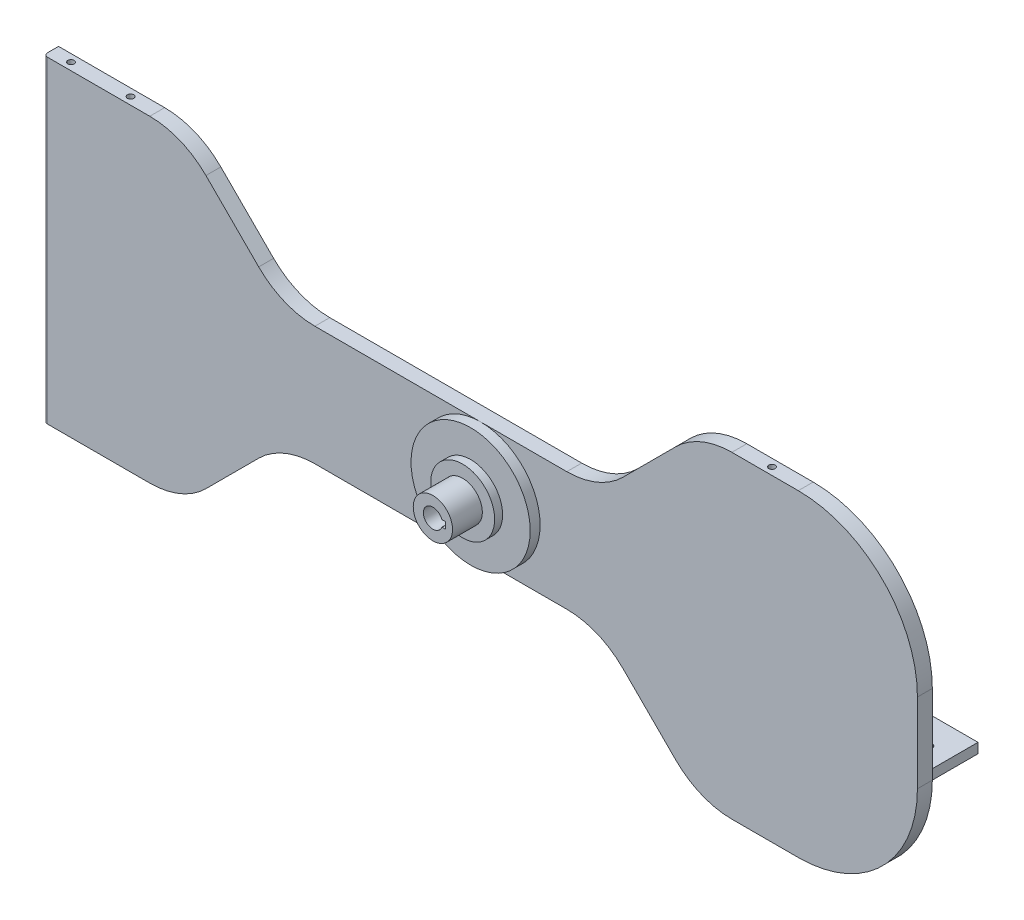
from build123d import *

# Parameters (mm, degrees)
BOSS_EXTRUDE1_DEPTH        = 9.525
SKETCH6_W                  = 509.27
SKETCH6_H                  = 6.35
BOSS_EXTRUDE3_DEPTH        = 35.56
SKETCH7_R                  = 2.286
CUT_EXTRUDE4_DEPTH         = 575.152378381
F_10_32_TAPPED_HOLE1_D     = 4.0386
F_10_32_TAPPED_HOLE1_DEPTH = 13.716
F_10_32_TAPPED_HOLE1_TIP   = 1.213317848
F_10_32_TAPPED_HOLE2_D     = 4.0386
F_10_32_TAPPED_HOLE2_DEPTH = 13.716
F_10_32_TAPPED_HOLE2_TIP   = 1.213317848
SKETCH12_R                 = 38.1
BOSS_EXTRUDE4_DEPTH        = 6.35
SKETCH13_R                 = 20.447
BOSS_EXTRUDE5_DEPTH        = 5.08
SKETCH14_R                 = 12.573
BOSS_EXTRUDE6_DEPTH        = 19.05
CUT_EXTRUDE5_DEPTH         = 19.05
FILLET1_R                  = 2.54
F_10_32_TAPPED_HOLE3_D     = 4.0386


with BuildPart() as part:
    # Sketch1 → Boss-Extrude1 (new body)
    with BuildSketch(Plane.XY):
        with BuildLine():
            Line((103.778975516, 188.321024484), (137.521024484, 154.578975516))
            ThreePointArc((137.521024484, 154.578975516), (154.001730604, 143.566919748), (173.442048969, 139.7))
            Line((173.442048969, 139.7), (334.557951031, 139.7))
            ThreePointArc((334.557951031, 139.7), (353.998269396, 143.566919748), (370.478975516, 154.578975516))
            Line((370.478975516, 154.578975516), (404.221024484, 188.321024484))
            ThreePointArc((404.221024484, 188.321024484), (420.701730604, 199.333080252), (440.142048969, 203.2))
            Line((440.142048969, 203.2), (482.6, 203.2))
            ThreePointArc((482.6, 203.2), (536.481536726, 180.881536726), (558.8, 127))
            Line((558.8, 127), (558.8, 76.2))
            ThreePointArc((558.8, 76.2), (536.481536726, 22.318463274), (482.6, 0))
            Line((482.6, 0), (440.142048969, 0))
            ThreePointArc((440.142048969, 0), (420.701730604, 3.866919748), (404.221024484, 14.878975516))
            Line((404.221024484, 14.878975516), (370.478975516, 48.621024484))
            ThreePointArc((370.478975516, 48.621024484), (353.998269396, 59.633080252), (334.557951031, 63.5))
            Line((334.557951031, 63.5), (173.442048969, 63.5))
            ThreePointArc((173.442048969, 63.5), (154.001730604, 59.633080252), (137.521024484, 48.621024484))
            Line((137.521024484, 48.621024484), (103.778975516, 14.878975516))
            ThreePointArc((103.778975516, 14.878975516), (87.298269396, 3.866919748), (67.857951031, 0))
            Line((67.857951031, 0), (0, 0))
            Line((0, 0), (0, 203.2))
            Line((0, 203.2), (67.857951031, 203.2))
            ThreePointArc((67.857951031, 203.2), (87.298269396, 199.333080252), (103.778975516, 188.321024484))
        make_face()
    extrude(amount=BOSS_EXTRUDE1_DEPTH)

    # Sketch6 → Boss-Extrude3 (add)
    with BuildSketch(Plane(origin=(0, 0, 0), x_dir=(-1, 0, 0), z_dir=(0, 0, -1))):
        with Locations((-297.815, 73.025)):
            Rectangle(SKETCH6_W, SKETCH6_H)
    extrude(amount=BOSS_EXTRUDE3_DEPTH)

    # Sketch7 → Cut-Extrude4 (cut, through all)
    with BuildSketch(Plane(origin=(0, 76.2, 0), x_dir=(1, 0, 0), z_dir=(0, 1, 0))):
        with Locations(Location((58.166, 17.78, 0), (0, 0, 270))):
            Circle(SKETCH7_R)
        with Locations(Location((538.734, 17.78, 0), (0, 0, 270))):
            Circle(SKETCH7_R)
    extrude(amount=-CUT_EXTRUDE4_DEPTH, mode=Mode.SUBTRACT)

    # #10-32 Tapped Hole1
    with Locations(Plane(origin=(0, 203.2, 0), x_dir=(-1, 0, 0), z_dir=(0, 1, 0))):
        with Locations((-12.7, 4.7625), (-50.8, 4.7625), (-461.01, 4.7625)):
            Hole(F_10_32_TAPPED_HOLE1_D / 2, depth=F_10_32_TAPPED_HOLE1_DEPTH)
            with Locations((0, 0, -(F_10_32_TAPPED_HOLE1_DEPTH + F_10_32_TAPPED_HOLE1_TIP / 2))):  # 118° drill point
                Cone(0, F_10_32_TAPPED_HOLE1_D / 2, F_10_32_TAPPED_HOLE1_TIP, mode=Mode.SUBTRACT)

    # #10-32 Tapped Hole2
    with Locations(Plane.XZ):
        with Locations((12.7, 4.7625), (50.8, 4.7625), (461.01, 4.7625)):
            Hole(F_10_32_TAPPED_HOLE2_D / 2, depth=F_10_32_TAPPED_HOLE2_DEPTH)
            with Locations((0, 0, -(F_10_32_TAPPED_HOLE2_DEPTH + F_10_32_TAPPED_HOLE2_TIP / 2))):  # 118° drill point
                Cone(0, F_10_32_TAPPED_HOLE2_D / 2, F_10_32_TAPPED_HOLE2_TIP, mode=Mode.SUBTRACT)

    # Sketch12 → Boss-Extrude4 (add)
    with BuildSketch(Plane.XY.offset(9.525)):
        with Locations(Location((279.4, 101.6, 0), (0, 0, 270))):
            Circle(SKETCH12_R)
    extrude(amount=BOSS_EXTRUDE4_DEPTH)

    # Sketch13 → Boss-Extrude5 (add)
    with BuildSketch(Plane.XY.offset(15.875)):
        with Locations((279.4, 101.6)):
            Circle(SKETCH13_R)
    extrude(amount=BOSS_EXTRUDE5_DEPTH)

    # Sketch14 → Boss-Extrude6 (add)
    with BuildSketch(Plane.XY.offset(20.955)):
        with Locations(Location((279.4, 101.6, 0), (0, 0, 180))):
            Circle(SKETCH14_R)
    extrude(amount=BOSS_EXTRUDE6_DEPTH)

    # Sketch15 → Cut-Extrude5 (cut)
    with BuildSketch(Plane.XY.offset(40.005)):
        with BuildLine():
            Line((287.401, 103.7082), (287.401, 99.4918))
            Line((287.401, 99.4918), (285.294277832, 99.4918))
            ThreePointArc((285.294277832, 99.4918), (285.151947147, 99.448175797), (285.058506719, 99.332288))
            ThreePointArc((285.058506719, 99.332288), (273.304, 101.6), (285.058506719, 103.867712))
            ThreePointArc((285.058506719, 103.867712), (285.151947147, 103.751824203), (285.294277832, 103.7082))
            Line((285.294277832, 103.7082), (287.401, 103.7082))
        make_face()
    extrude(amount=-CUT_EXTRUDE5_DEPTH, mode=Mode.SUBTRACT)

    # Fillet1
    fillet1_edges = [part.edges().sort_by_distance(p)[0] for p in [
        (0, 101.6, 9.525),
    ]]
    fillet(fillet1_edges, radius=FILLET1_R)

    # #10-32 Tapped Hole3 (through all)
    with Locations(Plane(origin=(279.4, 101.6, 20.955), x_dir=(1, 0, 0), z_dir=(0, 0, 1))):
        with Locations((0, 0)):
            Hole(F_10_32_TAPPED_HOLE3_D / 2)


solid = part.part
